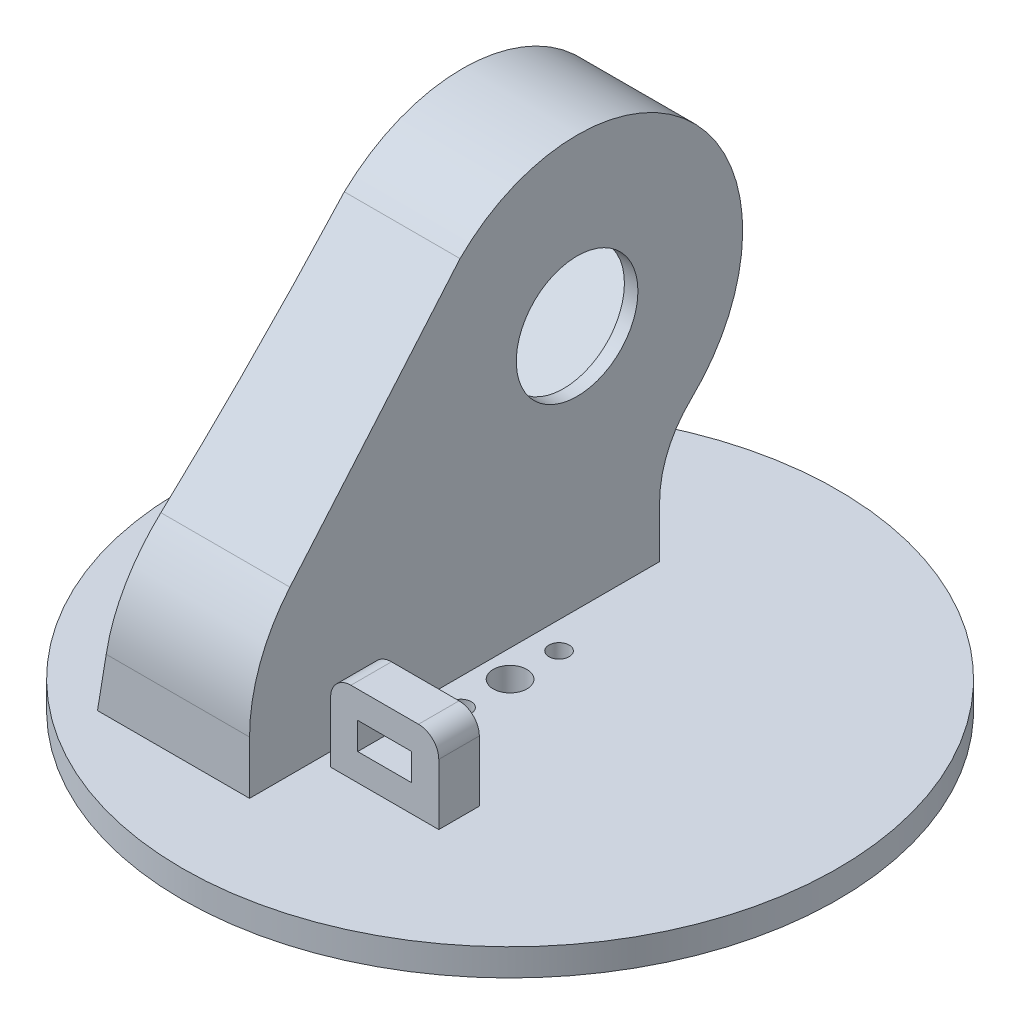
from build123d import *

# Parameters (mm, degrees)
SKETCH2_R                       = 48.5
BOSS_EXTRUDE1_DEPTH             = 4
SKETCH4_R                       = 1.5
CUT_EXTRUDE2_DEPTH              = 69.705894944
SKETCH5_R                       = 2.5
CUT_EXTRUDE3_DEPTH              = 69.705894944
BOSS_EXTRUDE2_DEPTH             = 14
CUT_EXTRUDE5_REACH              = 97.597
SKETCH9_R                       = 1.3
CUT_EXTRUDE6_DEPTH              = 7.5
CUT_EXTRUDE9_REACH              = 96.471
SKETCH11_R                      = 9
BOSS_EXTRUDE7_DEPTH             = 9
BOSS_EXTRUDE7_DIRECTION_2_REACH = 104.912
BOSS_EXTRUDE10_DEPTH            = 9
SKETCH27_W                      = 16
SKETCH27_H                      = 6
BOSS_EXTRUDE11_DEPTH            = 12
FILLET6_R                       = 3
CUT_EXTRUDE16_REACH             = 111.016
SKETCH28_W                      = 8
SKETCH28_H                      = 4
CUT_EXTRUDE17_DEPTH             = 95.342420983
CUT_EXTRUDE17_DEPTH_BACK        = 95.342420983


with BuildPart() as part:
    # Sketch2 → Boss-Extrude1 (new body)
    with BuildSketch(Plane(origin=(0, 0, 0), x_dir=(1, 0, 0), z_dir=(0, 1, 0))):
        with Locations(Location((0, 0, 0), (0, 0, 270))):
            Circle(SKETCH2_R)
    extrude(amount=BOSS_EXTRUDE1_DEPTH)

    # Sketch4 → Cut-Extrude2 (cut, through all)
    with BuildSketch(Plane.XZ):
        with Locations(Location((0, 7.25, 0), (0, 0, 270))):
            Circle(SKETCH4_R)
        with Locations(Location((0, -7.25, 0), (0, 0, 270))):
            Circle(SKETCH4_R)
    extrude(amount=-CUT_EXTRUDE2_DEPTH, mode=Mode.SUBTRACT)

    # Sketch5 → Cut-Extrude3 (cut, through all)
    with BuildSketch(Plane.XZ):
        with Locations(Location((0, 0, 0), (0, 0, 270))):
            Circle(SKETCH5_R)
    extrude(amount=-CUT_EXTRUDE3_DEPTH, mode=Mode.SUBTRACT)

    # Sketch7 → Boss-Extrude2 (add)
    with BuildSketch(Plane(origin=(-4, 0, 0), x_dir=(0, 0, -1), z_dir=(1, 0, 0))):
        with BuildLine():
            Line((23.129947874, 4), (23.129947874, 11.644549616))
            ThreePointArc((23.129947874, 11.644549616), (24.589048403, 18.743749901), (28.729797284, 24.692011643))
            ThreePointArc((28.729797284, 24.692011643), (29.313383054, 55.284736897), (-1.284289494, 55.479275971))
            Line((-1.284289494, 55.479275971), (-27.227315747, 29.536249718))
            ThreePointArc((-27.227315747, 29.536249718), (-32.64663453, 21.425665997), (-34.549646217, 11.858580188))
            Line((-34.549646217, 11.858580188), (-34.549646217, 4))
            Line((-34.549646217, 4), (23.129947874, 4))
        make_face()
    extrude(amount=-BOSS_EXTRUDE2_DEPTH)

    # Sketch8 → Cut-Extrude5 (cut, up to next)
    with BuildSketch(Plane(origin=(-6, 0, 0), x_dir=(0, 0, -1), z_dir=(1, 0, 0)), mode=Mode.PRIVATE) as cut_extrude5_sk1:
        Polygon((-15.249648422, 25.957567857), (13.741729607, 54.948945886), (28.590972012, 40.099703481), (-0.400406017, 11.108325452), align=None)
    cut_extrude5_tool1 = extrude(cut_extrude5_sk1.sketch, amount=-CUT_EXTRUDE5_REACH, mode=Mode.PRIVATE) & part.part
    add(cut_extrude5_tool1.solids().sort_by_distance((-6, 33.028636, -6.670662))[0], mode=Mode.SUBTRACT)

    # Sketch9 → Cut-Extrude6 (cut)
    with BuildSketch(Plane.ZY.offset(18)):
        with Locations((-20.105690637, 53.534732323)):
            Circle(SKETCH9_R)
        with Locations((-27.176758449, 46.463664511)):
            Circle(SKETCH9_R)
        with Locations((6.764367048, 12.522539014)):
            Circle(SKETCH9_R)
        with Locations((13.83543486, 19.593606826)):
            Circle(SKETCH9_R)
    extrude(amount=-CUT_EXTRUDE6_DEPTH, mode=Mode.SUBTRACT)

    # Sketch11 → Cut-Extrude9 (cut, up to next)
    with BuildSketch(Plane(origin=(-4, 0, 0), x_dir=(0, 0, -1), z_dir=(1, 0, 0)), mode=Mode.PRIVATE) as cut_extrude9_sk1:
        with Locations((13.918506302, 40.276480176)):
            Circle(SKETCH11_R)
    cut_extrude9_tool1 = extrude(cut_extrude9_sk1.sketch, amount=-CUT_EXTRUDE9_REACH, mode=Mode.PRIVATE) & part.part
    add(cut_extrude9_tool1.solids().sort_by_distance((-4, 40.27648, -13.918506))[0], mode=Mode.SUBTRACT)

    # Sketch17 → Boss-Extrude7 (add)
    with BuildSketch(Plane.ZY.offset(18)):
        with BuildLine():
            ThreePointArc((34.549646217, 11.858580188), (33.008342843, 20.500891953), (28.574482006, 28.077569775))
            ThreePointArc((28.574482006, 28.077569775), (27.915386359, 28.820289685), (27.227315747, 29.536249718))
            Line((27.227315747, 29.536249718), (1.284289494, 55.479275971))
            Line((1.284289494, 55.479275971), (26.295003593, 26.127182305))
            ThreePointArc((26.295003593, 26.127182305), (30.194232218, 19.461281607), (31.549646217, 11.858580188))
            Line((31.549646217, 11.858580188), (31.549646217, 4))
            Line((31.549646217, 4), (34.549646217, 4))
            Line((34.549646217, 4), (34.549646217, 11.858580188))
        make_face()
        with BuildLine():
            Line((28.574482006, 28.077569775), (3.405609837, 57.600596315))
            ThreePointArc((3.405609837, 57.600596315), (-31.461505391, 57.378912253), (-30.796489049, 22.517434639))
            ThreePointArc((-30.796489049, 22.517434639), (-27.345864981, 17.560549854), (-26.129947874, 11.644549616))
            Line((-26.129947874, 11.644549616), (-26.129947874, 4))
            Line((-26.129947874, 4), (-23.129947874, 4))
            Line((-23.129947874, 4), (-23.129947874, 11.644549616))
            ThreePointArc((-23.129947874, 11.644549616), (-24.589048403, 18.743749901), (-28.729797284, 24.692011643))
            ThreePointArc((-28.729797284, 24.692011643), (-29.313383054, 55.284736897), (1.284289494, 55.479275971))
            Line((1.284289494, 55.479275971), (27.227315747, 29.536249718))
            ThreePointArc((27.227315747, 29.536249718), (27.915386359, 28.820289685), (28.574482006, 28.077569775))
        make_face()
    extrude(amount=BOSS_EXTRUDE7_DEPTH)

    # Boss-Extrude7 direction 2: up to this face of the body (flat: up to its plane)
    boss_extrude7_direction_2_end = Plane(part.part.faces().sort_by_distance((-4, 28.276431801, -1.649713195))[0])
    # Sketch17 → Boss-Extrude7 direction 2 (add, up to the picked face)
    with BuildSketch(Plane.ZY.offset(18), mode=Mode.PRIVATE) as boss_extrude7_direction_2_sk1:
        with BuildLine():
            ThreePointArc((34.549646217, 11.858580188), (33.008342843, 20.500891953), (28.574482006, 28.077569775))
            ThreePointArc((28.574482006, 28.077569775), (27.915386359, 28.820289685), (27.227315747, 29.536249718))
            Line((27.227315747, 29.536249718), (1.284289494, 55.479275971))
            Line((1.284289494, 55.479275971), (26.295003593, 26.127182305))
            ThreePointArc((26.295003593, 26.127182305), (30.194232218, 19.461281607), (31.549646217, 11.858580188))
            Line((31.549646217, 11.858580188), (31.549646217, 4))
            Line((31.549646217, 4), (34.549646217, 4))
            Line((34.549646217, 4), (34.549646217, 11.858580188))
        make_face()
    boss_extrude7_direction_2_tool1 = split(extrude(boss_extrude7_direction_2_sk1.sketch, amount=-BOSS_EXTRUDE7_DIRECTION_2_REACH, mode=Mode.PRIVATE), bisect_by=boss_extrude7_direction_2_end, keep=Keep.BOTH, mode=Mode.PRIVATE)
    # Sketch17 → Boss-Extrude7 direction 2 (add, up to the picked face)
    with BuildSketch(Plane.ZY.offset(18), mode=Mode.PRIVATE) as boss_extrude7_direction_2_sk2:
        with BuildLine():
            Line((28.574482006, 28.077569775), (3.405609837, 57.600596315))
            ThreePointArc((3.405609837, 57.600596315), (-31.461505391, 57.378912253), (-30.796489049, 22.517434639))
            ThreePointArc((-30.796489049, 22.517434639), (-27.345864981, 17.560549854), (-26.129947874, 11.644549616))
            Line((-26.129947874, 11.644549616), (-26.129947874, 4))
            Line((-26.129947874, 4), (-23.129947874, 4))
            Line((-23.129947874, 4), (-23.129947874, 11.644549616))
            ThreePointArc((-23.129947874, 11.644549616), (-24.589048403, 18.743749901), (-28.729797284, 24.692011643))
            ThreePointArc((-28.729797284, 24.692011643), (-29.313383054, 55.284736897), (1.284289494, 55.479275971))
            Line((1.284289494, 55.479275971), (27.227315747, 29.536249718))
            ThreePointArc((27.227315747, 29.536249718), (27.915386359, 28.820289685), (28.574482006, 28.077569775))
        make_face()
    boss_extrude7_direction_2_tool2 = split(extrude(boss_extrude7_direction_2_sk2.sketch, amount=-BOSS_EXTRUDE7_DIRECTION_2_REACH, mode=Mode.PRIVATE), bisect_by=boss_extrude7_direction_2_end, keep=Keep.BOTH, mode=Mode.PRIVATE)
    add(boss_extrude7_direction_2_tool1.solids().sort_by(Axis((-18, 4.612919, 33.049646), (1, 0, 0)))[0])
    add(boss_extrude7_direction_2_tool2.solids().sort_by(Axis((-18, 43.147366, 14.895406), (1, 0, 0)))[0])

    # Sketch25 → Boss-Extrude10 (add)
    with BuildSketch(Plane.ZY.offset(18)):
        with BuildLine():
            ThreePointArc((-28.729797284, 24.692011643), (-24.589048403, 18.743749901), (-23.129947874, 11.644549616))
            Line((-23.129947874, 11.644549616), (-23.129947874, 4))
            Line((-23.129947874, 4), (-15.129947874, 4))
            add(Edge.make_bspline(
                [(-28.729797284, 24.692011643), (-21.954867515, 18.253200081), (-19.09405247, 12.798017691), (-15.129947874, 4)],
                knots=[0, 0, 0, 0, 1, 1, 1, 1], degree=3))
        make_face()
        with BuildLine():
            add(Edge.make_bspline(
                [(11.751619577, 43.19501844), (26.551255916, 25.8264495), (25.549646217, 4)],
                knots=[0, 0, 0, 1, 1, 1], degree=2))
            Line((25.549646217, 4), (31.549646217, 4))
            Line((31.549646217, 4), (31.549646217, 11.858580188))
            ThreePointArc((31.549646217, 11.858580188), (30.194232218, 19.461281607), (26.295003593, 26.127182305))
            Line((26.295003593, 26.127182305), (11.751619577, 43.19501844))
        make_face()
    extrude(amount=BOSS_EXTRUDE10_DEPTH)

    # Sketch27 → Boss-Extrude11 (add)
    with BuildSketch(Plane(origin=(0, 4, 0), x_dir=(1, 0, 0), z_dir=(0, 1, 0))):
        with Locations((6, -21.549646217)):
            Rectangle(SKETCH27_W, SKETCH27_H)
    extrude(amount=BOSS_EXTRUDE11_DEPTH)

    # Fillet6
    fillet6_edges = [part.edges().sort_by_distance(p)[0] for p in [
        (-2, 16, 21.549646217),
        (14, 16, 21.549646217),
    ]]
    fillet(fillet6_edges, radius=FILLET6_R)

    # Sketch28 → Cut-Extrude16 (cut, up to next)
    with BuildSketch(Plane.XY.offset(24.549646217), mode=Mode.PRIVATE) as cut_extrude16_sk1:
        with Locations((6, 10)):
            Rectangle(SKETCH28_W, SKETCH28_H)
    cut_extrude16_tool1 = extrude(cut_extrude16_sk1.sketch, amount=-CUT_EXTRUDE16_REACH, mode=Mode.PRIVATE) & part.part
    add(cut_extrude16_tool1.solids().sort_by_distance((6, 10, 24.549646))[0], mode=Mode.SUBTRACT)

    # Sketch29 → Cut-Extrude17 (cut, two sides: drawn at the far end of the back side and taken through both)
    with BuildSketch(Plane.XY.offset(-CUT_EXTRUDE17_DEPTH_BACK)):
        with BuildLine():
            Line((-21, 64.776480176), (-27, 64.776480176))
            Line((-27, 64.776480176), (-27, 4))
            Line((-27, 4), (-26.5, 4))
            add(Edge.make_bspline(
                [(-21, 64.776480176), (-21.220459696, 34.140901434), (-26.5, 4)],
                knots=[0, 0, 0, 1, 1, 1], degree=2))
        make_face()
    extrude(amount=CUT_EXTRUDE17_DEPTH + CUT_EXTRUDE17_DEPTH_BACK, mode=Mode.SUBTRACT)


solid = part.part
